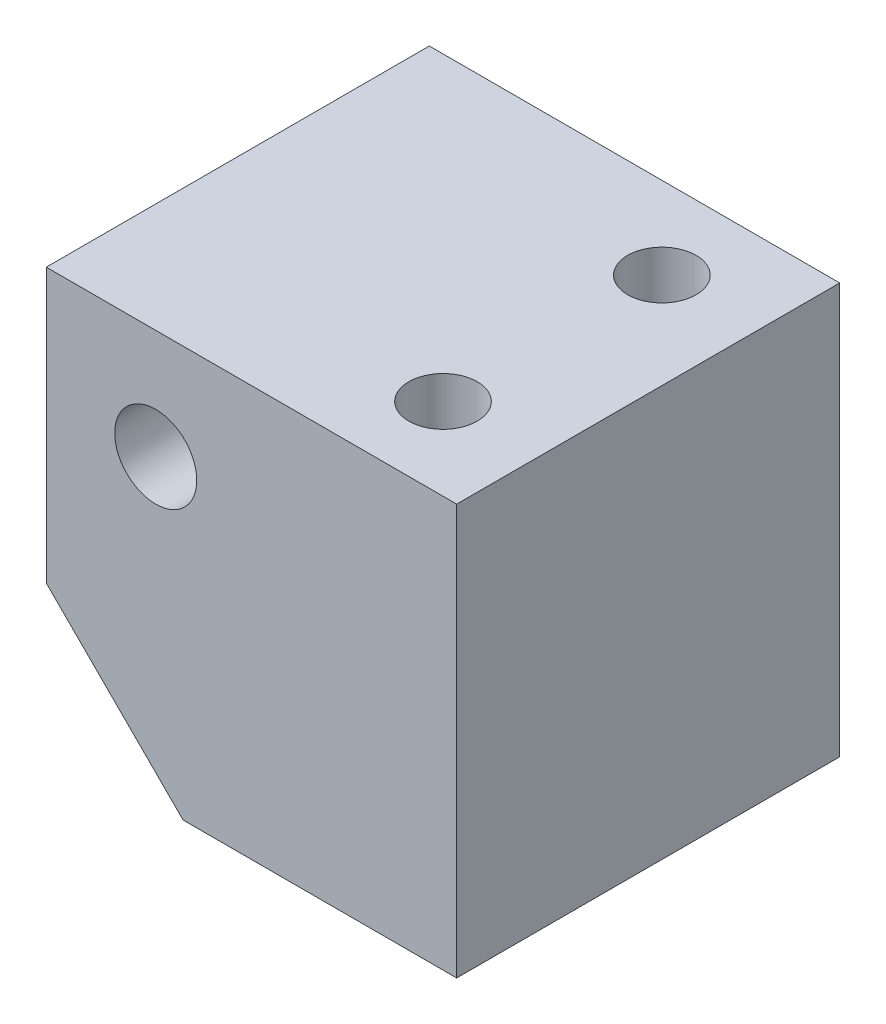
from build123d import *

# Parameters (mm, degrees)
SKETCH_1_R          = 1.5
EXTRUDE_1_DEPTH     = 14
SKETCH_2_R          = 1.25
CUT_EXTRUDE_1_DEPTH = 15


with BuildPart() as part:
    # 草图1 → 凸台-拉伸1 (new body)
    with BuildSketch(Plane.XY):
        Polygon((-5, -10), (0, -15), (10, -15), (10, 0), (-5, 0), align=None)
        with Locations((-1, -4)):
            Circle(SKETCH_1_R, mode=Mode.SUBTRACT)
    extrude(amount=EXTRUDE_1_DEPTH)

    # 草图2 → 切除-拉伸1 (cut)
    with BuildSketch(Plane(origin=(0, 0, 0), x_dir=(1, 0, 0), z_dir=(0, 1, 0))):
        with Locations(Location((6.5, -3, 0), (0, 0, 270))):
            Circle(SKETCH_2_R)
        with Locations(Location((6.5, -11, 0), (0, 0, 270))):
            Circle(SKETCH_2_R)
    extrude(amount=-CUT_EXTRUDE_1_DEPTH, mode=Mode.SUBTRACT)


solid = part.part
